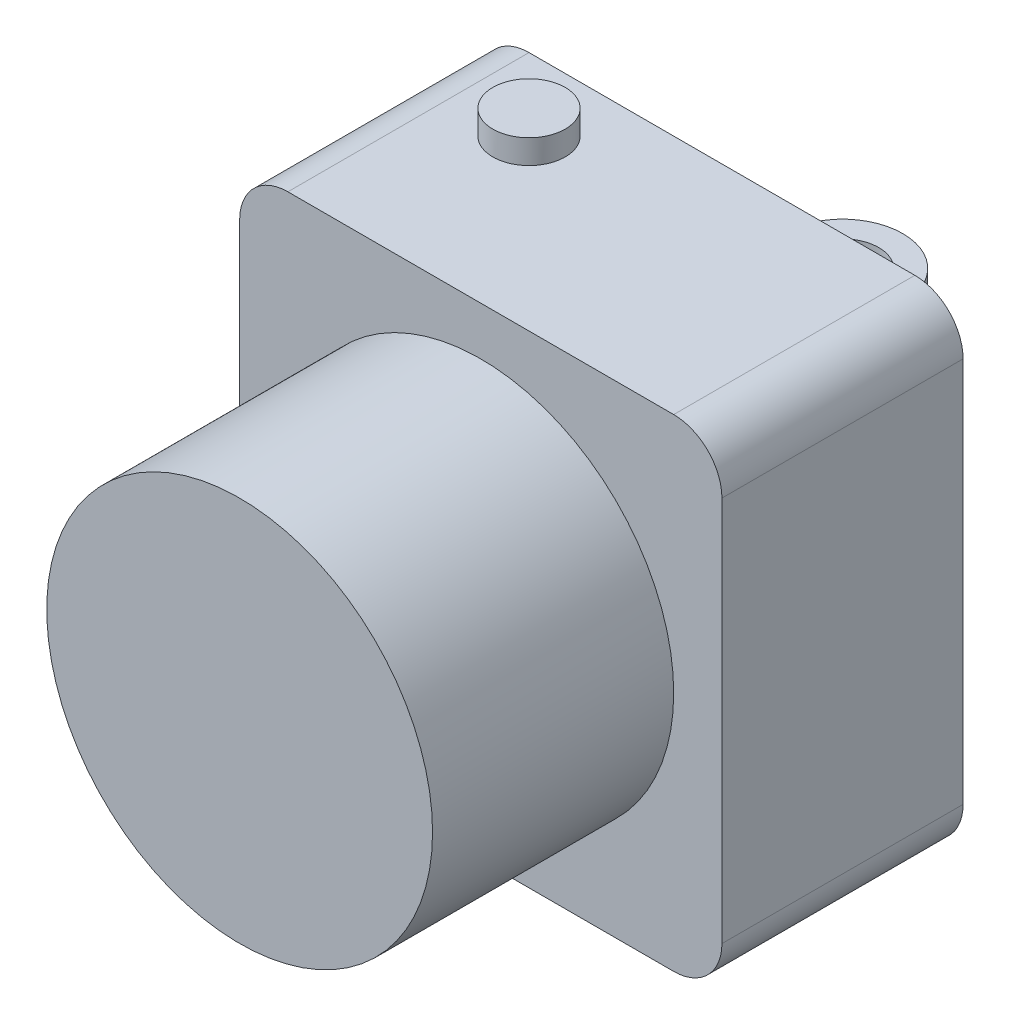
from build123d import *

# Parameters (mm, degrees)
SKETCH1_W           = 25.4
SKETCH1_H           = 25.4
BOSS_EXTRUDE1_DEPTH = 12.7
SKETCH3_W           = 25.4
SKETCH3_H           = 25.4
SKETCH3_R           = 10.16
CUT_EXTRUDE1_DEPTH  = 12.7
FILLET1_R           = 2.54
SKETCH4_R           = 1.905
BOSS_EXTRUDE3_DEPTH = 1.27
SKETCH5_R           = 1.905
BOSS_EXTRUDE4_DEPTH = 9.525


with BuildPart() as part:
    # Sketch1 → Boss-Extrude1 (new, symmetric)
    with BuildSketch(Plane.XY):
        Rectangle(SKETCH1_W, SKETCH1_H)
    extrude(amount=BOSS_EXTRUDE1_DEPTH, both=True)

    # Sketch3 → Cut-Extrude1 (cut)
    with BuildSketch(Plane.XY.offset(12.7)):
        Rectangle(SKETCH3_W, SKETCH3_H)
        Circle(SKETCH3_R, mode=Mode.SUBTRACT)
    extrude(amount=-CUT_EXTRUDE1_DEPTH, mode=Mode.SUBTRACT)

    # Fillet1
    fillet1_edges = [part.edges().sort_by_distance(p)[0] for p in [
        (12.7, -12.7, -6.35),
        (-12.7, -12.7, -6.35),
        (-12.7, 12.7, -6.35),
        (12.7, 12.7, -6.35),
    ]]
    fillet(fillet1_edges, radius=FILLET1_R)

    # Sketch4 → Boss-Extrude3 (add, symmetric)
    with BuildSketch(Plane(origin=(0, 12.7, 0), x_dir=(1, 0, 0), z_dir=(0, 1, 0))):
        with Locations(Location((-6.35, 8.89, 0), (0, 0, 90))):
            Circle(SKETCH4_R)
    extrude(amount=BOSS_EXTRUDE3_DEPTH, both=True)

    # Sketch5 → Boss-Extrude4 (add)
    with BuildSketch(Plane(origin=(0, 4.7625, 0), x_dir=(1, 0, 0), z_dir=(0, 1, 0))):
        with BuildLine():
            Line((-3.175, 12.7), (3.175, 12.7))
            Line((3.175, 12.7), (3.175, 19.05))
            ThreePointArc((3.175, 19.05), (0, 22.225), (-3.175, 19.05))
            Line((-3.175, 19.05), (-3.175, 12.7))
        make_face()
        with Locations(Location((0, 19.05, 0), (0, 0, 270))):
            Circle(SKETCH5_R, mode=Mode.SUBTRACT)
    extrude(amount=-BOSS_EXTRUDE4_DEPTH)


solid = part.part
